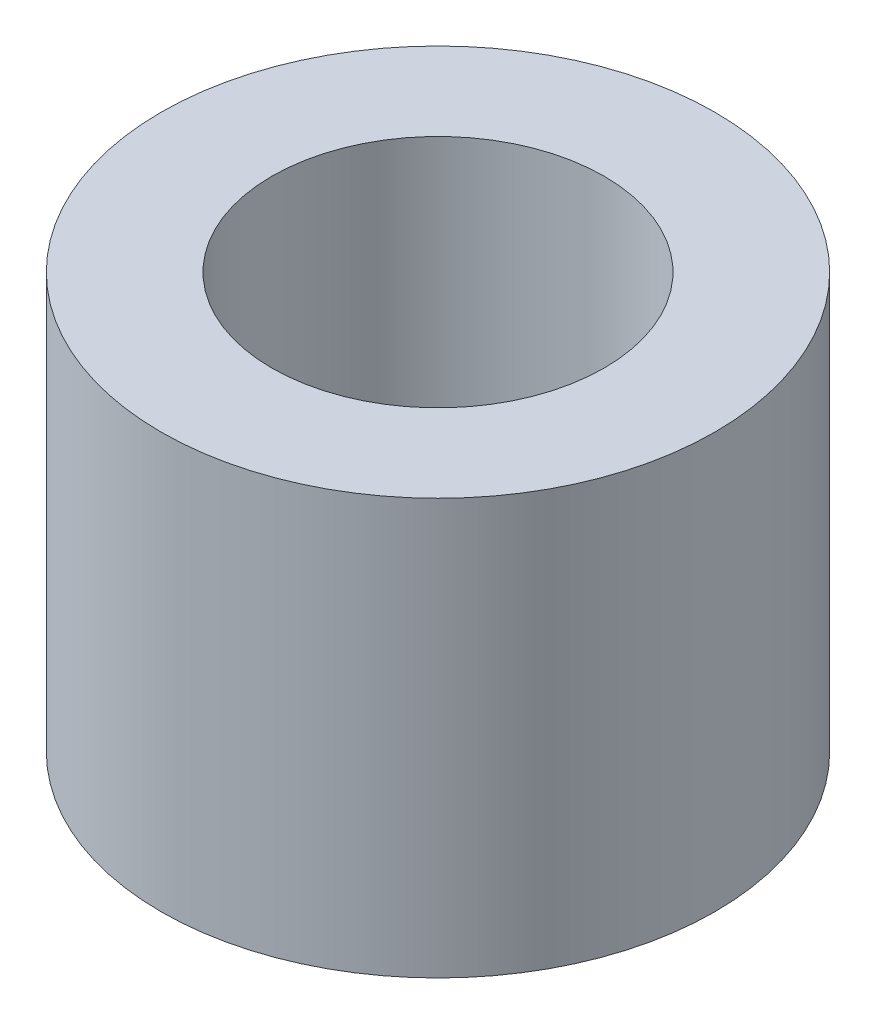
from build123d import *

# Parameters (mm, degrees)
SKETCH1_R           = 2
SKETCH1_R_2         = 1.2
BOSS_EXTRUDE1_DEPTH = 3


with BuildPart() as part:
    # Sketch1 → Boss-Extrude1 (new body)
    with BuildSketch(Plane(origin=(0, 0, 0), x_dir=(1, 0, 0), z_dir=(0, 1, 0))):
        with Locations(Location((0, 0, 0), (0, 0, 270))):
            Circle(SKETCH1_R)
        with Locations(Location((0, 0, 0), (0, 0, 270))):
            Circle(SKETCH1_R_2, mode=Mode.SUBTRACT)
    extrude(amount=BOSS_EXTRUDE1_DEPTH)


solid = part.part
